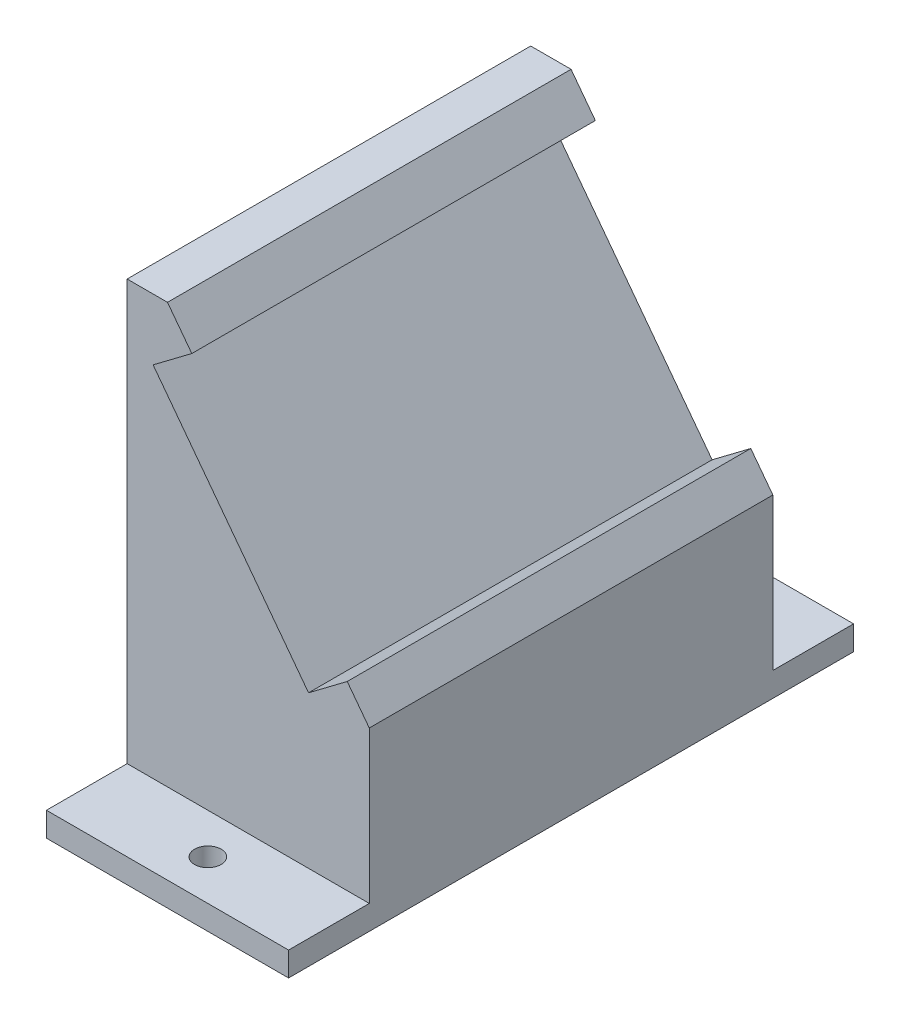
from build123d import *

# Parameters (mm, degrees)
EXTRUDE_1_DEPTH      = 25
EXTRUDE_1_DEPTH_BACK = 25
SKETCH_2_W           = 30
SKETCH_2_H           = 3
EXTRUDE_2_DEPTH      = 10
SKETCH_3_R           = 1.65
CUT_EXTRUDE_1_DEPTH  = 3


with BuildPart() as part:
    # 草图1 → 凸台-拉伸1 (new, two sides: drawn at the far end of the back side and taken through both)
    with BuildSketch(Plane.XY.offset(-EXTRUDE_1_DEPTH_BACK)):
        Polygon((-10, 55), (-15, 55), (-15, 0), (15, 0), (15, 21.823879459), (12.267155857, 25.450486128), (7.475342796, 21.839595989), (-11.782737945, 47.395932311), (-6.990924884, 51.00682245), align=None)
    extrude(amount=EXTRUDE_1_DEPTH + EXTRUDE_1_DEPTH_BACK)

    # 草图2 → 凸台-拉伸2 (add)
    with BuildSketch(Plane.XY.offset(25)):
        with Locations((0, 1.5)):
            Rectangle(SKETCH_2_W, SKETCH_2_H)
    extrude_2 = extrude(amount=EXTRUDE_2_DEPTH)

    # 草图3 → 切除-拉伸1 (cut)
    with BuildSketch(Plane(origin=(0, 3, 0), x_dir=(1, 0, 0), z_dir=(0, 1, 0))):
        with Locations(Location((0, -30, 0), (0, 0, 270))):
            Circle(SKETCH_3_R)
    cut_extrude_1 = extrude(amount=-CUT_EXTRUDE_1_DEPTH, mode=Mode.SUBTRACT)

    # 镜向1: 凸台-拉伸2, 切除-拉伸1 across plane
    add(extrude_2.mirror(Plane.XY))
    add(cut_extrude_1.mirror(Plane.XY), mode=Mode.SUBTRACT)


solid = part.part
